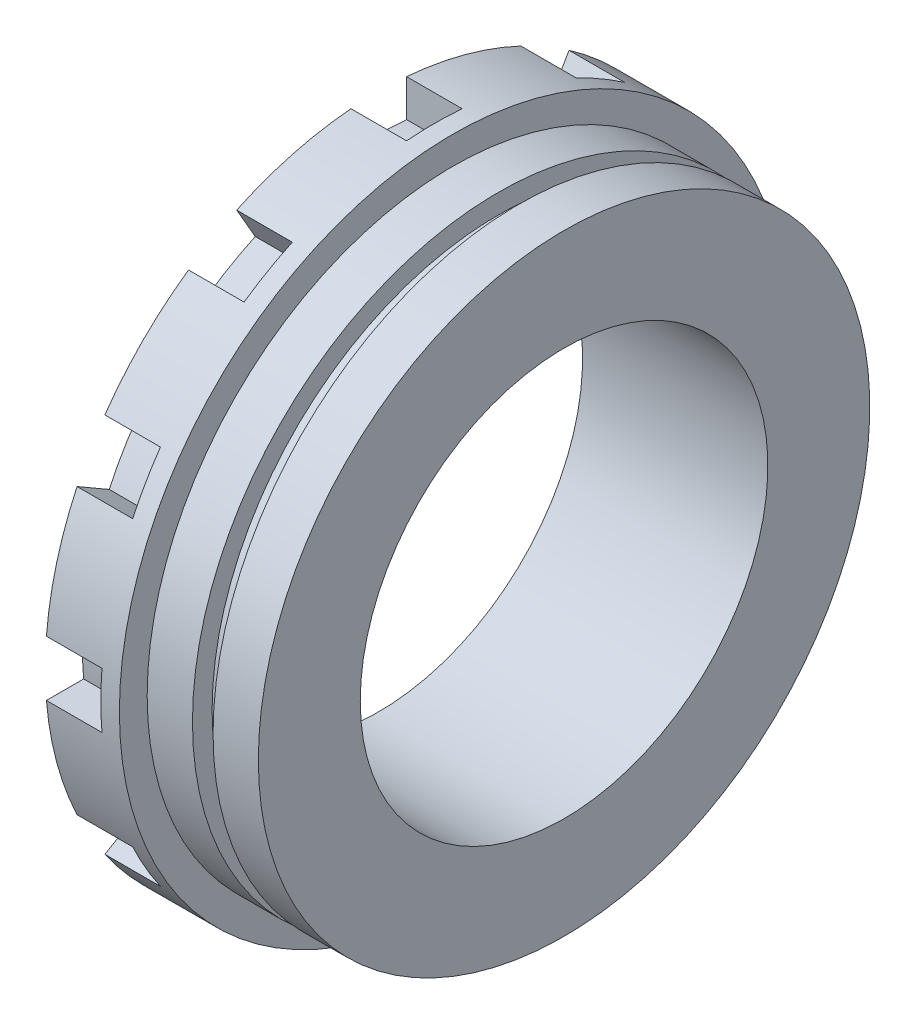
from build123d import *

# Parameters (mm, degrees)
CUT_EXTRUDE1_START = -9.525
CUT_EXTRUDE1_DEPTH = 9.525
CIRPATTERN1_COUNT  = 12


with BuildPart() as part:
    # Sketch2 → Revolve1 (revolve)
    with BuildSketch(Plane.XY, mode=Mode.PRIVATE) as revolve1_sk:
        Polygon((-22.225, 57.15), (-9.525, 57.15), (-9.525, 52.3875), (-1.7653, 52.3875), (-1.7653, 49.022), (1.7653, 49.022), (1.7653, 52.3875), (9.525, 52.3875), (9.525, 34.925), (-22.225, 34.925), align=None)
    revolve(revolve1_sk.sketch.rotate(Axis((0, 0, 0), (1, 0, 0)), 90), axis=Axis((0, 0, 0), (1, 0, 0)))

    # Sketch3 → Cut-Extrude1 (cut)
    with BuildSketch(Plane.ZY.offset(22.225).offset(CUT_EXTRUDE1_START)):
        with BuildLine():
            Line((-4.7625, 56.951216789), (-4.7625, 50.576265123))
            ThreePointArc((-4.7625, 50.576265123), (0, 50.8), (4.7625, 50.576265123))
            Line((4.7625, 50.576265123), (4.7625, 56.951216789))
            ThreePointArc((4.7625, 56.951216789), (0, 57.15), (-4.7625, 56.951216789))
        make_face()
    cut_extrude1 = extrude(amount=CUT_EXTRUDE1_DEPTH, mode=Mode.SUBTRACT)

    # CirPattern1: Cut-Extrude1 ×12 about axis
    cirpattern1_axis = Axis((0, 0, 0), (1, 0, 0))
    for i in range(1, CIRPATTERN1_COUNT):
        add(cut_extrude1.rotate(cirpattern1_axis, i * 360 / CIRPATTERN1_COUNT), mode=Mode.SUBTRACT)


solid = part.part
